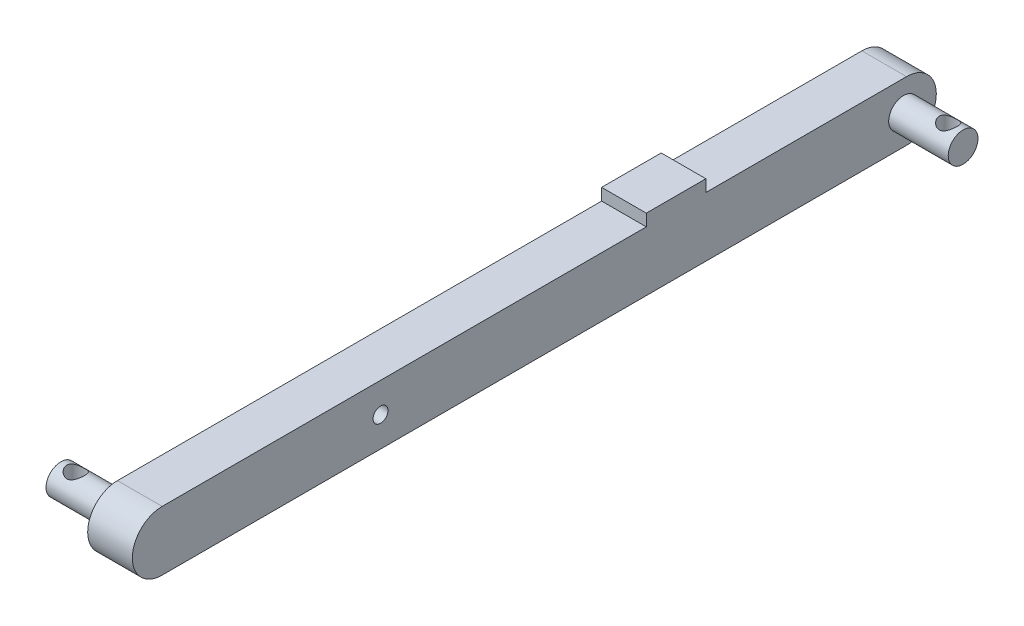
from build123d import *

# Parameters (mm, degrees)
BOSS_EXTRUDE1_DEPTH = 9.525
SKETCH4_R           = 6.35
BOSS_EXTRUDE2_DEPTH = 25.4
SKETCH5_R           = 6.35
BOSS_EXTRUDE3_DEPTH = 25.4
SKETCH6_R           = 3.175
CUT_EXTRUDE1_DEPTH  = 19.05
SKETCH10_W          = 19.05
SKETCH10_H          = 25.4
BOSS_EXTRUDE4_DEPTH = 5.08
SKETCH11_R          = 3.81
CUT_EXTRUDE2_DEPTH  = 6.35


with BuildPart() as part:
    # Sketch2 → Boss-Extrude1 (new, symmetric)
    with BuildSketch(Plane(origin=(0, 0, 0), x_dir=(0, 0, -1), z_dir=(1, 0, 0))):
        with BuildLine():
            Line((-158.75, 12.7), (158.75, 12.7))
            ThreePointArc((158.75, 12.7), (171.45, 0), (158.75, -12.7))
            Line((158.75, -12.7), (-158.75, -12.7))
            ThreePointArc((-158.75, -12.7), (-171.45, 0), (-158.75, 12.7))
        make_face()
    extrude(amount=BOSS_EXTRUDE1_DEPTH, both=True)

    # Sketch4 → Boss-Extrude2 (add)
    with BuildSketch(Plane.ZY.offset(9.525)):
        with Locations((157.48, 0)):
            Circle(SKETCH4_R)
    extrude(amount=BOSS_EXTRUDE2_DEPTH)

    # Sketch5 → Boss-Extrude3 (add)
    with BuildSketch(Plane(origin=(9.525, 0, 0), x_dir=(0, 0, -1), z_dir=(1, 0, 0))):
        with Locations(Location((157.48, 0, 0), (0, 0, 180))):
            Circle(SKETCH5_R)
    extrude(amount=BOSS_EXTRUDE3_DEPTH)

    # Sketch6 → Cut-Extrude1 (cut)
    with BuildSketch(Plane(origin=(9.525, 0, 0), x_dir=(0, 0, -1), z_dir=(1, 0, 0))):
        with Locations((-65.6082, 0)):
            Circle(SKETCH6_R)
    extrude(amount=-CUT_EXTRUDE1_DEPTH, mode=Mode.SUBTRACT)

    # Sketch10 → Boss-Extrude4 (add)
    with BuildSketch(Plane(origin=(0, 12.7, 0), x_dir=(1, 0, 0), z_dir=(0, 1, 0))):
        with Locations((0, 60.452)):
            Rectangle(SKETCH10_W, SKETCH10_H)
    extrude(amount=BOSS_EXTRUDE4_DEPTH)

    # Sketch11 → Cut-Extrude2 (cut, symmetric)
    with BuildSketch(Plane(origin=(0, 0, 0), x_dir=(1, 0, 0), z_dir=(0, 1, 0))):
        with Locations(Location((-28.575, -157.48, 0), (0, 0, 270))):
            Circle(SKETCH11_R)
        with Locations(Location((28.575, 157.48, 0), (0, 0, 270))):
            Circle(SKETCH11_R)
    extrude(amount=CUT_EXTRUDE2_DEPTH, both=True, mode=Mode.SUBTRACT)


solid = part.part
